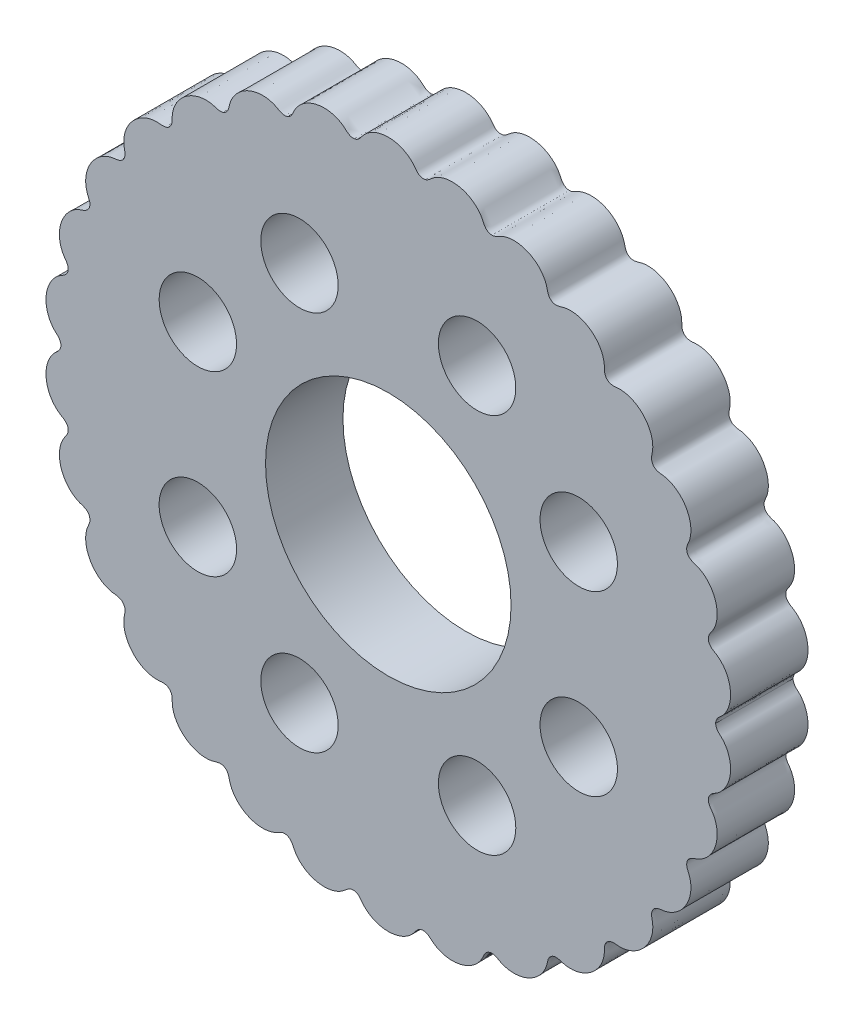
from build123d import *

# Parameters (mm, degrees)
BOSS_EXTRU_1_DEPTH      = 7
ESQUISSE2_R             = 3.5
ESQUISSE2_R_2           = 11.1
ENL_V_MAT_EXTRU_1_DEPTH = 45.429222529


with BuildPart() as part:
    # Esquisse1 → Boss.-Extru.1 (new body)
    with BuildSketch(Plane.XY):
        with BuildLine():
            add(Edge.make_bspline(
                [(29.6, 0), (29.6, -0.17346587), (29.759106864, -0.535683821), (30.110962154, -0.799020647), (30.373779595, -1.103467186), (30.671023666, -1.560938048), (30.906540811, -2.208142452), (30.979869374, -3.033375854), (30.845247931, -3.851352131), (30.565023341, -4.481835856), (30.246485608, -4.925727722), (29.960253365, -5.217593452), (29.640960083, -5.465239042), (29.250815494, -5.647425417), (28.885266009, -6.097323866), (28.977251739, -6.67834267), (29.271750181, -7.022312781), (29.468763653, -7.36916575), (29.619679918, -7.750390298), (29.740086607, -8.282593055), (29.751778171, -8.972575413), (29.555422294, -9.777910352), (29.16527121, -10.508677165), (28.695257551, -11.013160126), (28.244812231, -11.319043922), (27.880647842, -11.499834787), (27.471579825, -11.595893446), (27.006318633, -11.933415225), (26.943348567, -12.521679856), (27.160884744, -12.93167147), (27.28616792, -13.308128069), (27.382434324, -13.846858227), (27.347084399, -14.533511523), (27.091766805, -15.321922336), (26.647653324, -16.021873377), (26.143416519, -16.492765788), (25.676630094, -16.777708905), (25.300421903, -16.935538553), (24.906058058, -17.040890389), (24.494101091, -17.052935571), (23.964164193, -17.258068951), (23.748162441, -17.811308884), (23.871884113, -18.272098831), (23.921990477, -18.662658592), (23.912556095, -19.073830569), (23.816632957, -19.610230054), (23.55779036, -20.250114552), (23.0619827, -20.914113125), (22.524366522, -21.347803801), (22.039223061, -21.602326195), (21.65347199, -21.742191386), (21.253820824, -21.822573441), (20.844527947, -21.847377521), (20.445954866, -21.779629443), (19.887950327, -21.842445056), (19.533169106, -22.321486778), (19.54913905, -22.809933424), (19.52364967, -23.201313883), (19.402047704, -23.736377502), (19.102706862, -24.354093818), (18.559180614, -24.980010528), (17.876540404, -25.450186019), (17.228367831, -25.686652916), (16.687037507, -25.767074422), (16.279495117, -25.766957178), (15.872536835, -25.709400019), (15.499435367, -25.567806904), (14.951946533, -25.489634994), (14.482469666, -25.858978976), (14.381997189, -26.350233363), (14.28318815, -26.727726776), (14.113532411, -27.103499941), (13.817229931, -27.559932344), (13.328856115, -28.047927141), (12.612717453, -28.46490585), (11.815803643, -28.691258289), (11.125530625, -28.703647155), (10.592785504, -28.596321983), (10.204619525, -28.458251539), (9.869656438, -28.250580278), (9.36658074, -28.041508581), (8.815683348, -28.274758843), (8.597136023, -28.738509951), (8.428826025, -29.090348232), (8.107333171, -29.536038305), (7.592223672, -29.988306479), (6.846929131, -30.351760445), (6.034805208, -30.517180952), (5.345658074, -30.481539312), (4.815617997, -30.344351904), (4.439970071, -30.186483287), (4.086904742, -29.973347138), (3.798973513, -29.707611401), (3.371132482, -29.38740255), (2.777656314, -29.466938238), (2.447129594, -29.873895348), (2.215574619, -30.187513863), (1.912079782, -30.467158531), (1.462361721, -30.772632638), (0.822066691, -31.031016675), (2.605e-06, -31.134490934), (-0.822065298, -31.03101861), (-1.462347798, -30.772627846), (-1.912078643, -30.467167923), (-2.215568462, -30.18754546), (-2.446981162, -29.873962582), (-2.777700278, -29.466906136), (-3.371115881, -29.387410247), (-3.798972625, -29.707607875), (-4.086902915, -29.973347378), (-4.439969921, -30.186483038), (-4.815617939, -30.344351951), (-5.34565821, -30.481539306), (-6.034805188, -30.517180961), (-6.846929138, -30.351760446), (-7.592223668, -29.988306482), (-8.10733317, -29.536038305), (-8.428826025, -29.090348234), (-8.597136023, -28.738509951), (-8.815683348, -28.274758843), (-9.36658074, -28.041508581), (-9.869656438, -28.250580278), (-10.204619526, -28.458251539), (-10.592785504, -28.596321983), (-11.125530625, -28.703647155), (-11.815803643, -28.691258289), (-12.612717453, -28.46490585), (-13.328856115, -28.047927141), (-13.817229931, -27.559932344), (-14.113532411, -27.103499941), (-14.28318815, -26.727726776), (-14.381997189, -26.350233363), (-14.482469666, -25.858978976), (-14.951946533, -25.489634994), (-15.499435367, -25.567806904), (-15.872536835, -25.709400019), (-16.279495117, -25.766957178), (-16.687037507, -25.767074422), (-17.228367831, -25.686652916), (-17.876540404, -25.450186019), (-18.559180614, -24.980010528), (-19.102706862, -24.354093818), (-19.402047704, -23.736377502), (-19.52364967, -23.201313883), (-19.54913905, -22.809933424), (-19.533169106, -22.321486778), (-19.887950327, -21.842445056), (-20.445954866, -21.779629443), (-20.844527947, -21.847377521), (-21.253820824, -21.822573441), (-21.65347199, -21.742191386), (-22.039223061, -21.602326195), (-22.524366522, -21.347803801), (-23.0619827, -20.914113125), (-23.55779036, -20.250114552), (-23.816632957, -19.610230054), (-23.912556095, -19.073830569), (-23.921990477, -18.662658592), (-23.871884113, -18.272098831), (-23.748162441, -17.811308884), (-23.964164193, -17.258068951), (-24.494101091, -17.052935571), (-24.906058058, -17.040890389), (-25.300421903, -16.935538553), (-25.676630094, -16.777708905), (-26.143416519, -16.492765788), (-26.647653324, -16.021873377), (-27.091766805, -15.321922336), (-27.347084399, -14.533511523), (-27.382434324, -13.846858227), (-27.28616792, -13.308128069), (-27.160884744, -12.93167147), (-26.943348567, -12.521679856), (-27.006318633, -11.933415225), (-27.471579825, -11.595893446), (-27.880647842, -11.499834787), (-28.244812231, -11.319043922), (-28.695257551, -11.013160126), (-29.16527121, -10.508677165), (-29.555422294, -9.777910352), (-29.751778171, -8.972575413), (-29.740086607, -8.282593055), (-29.619679918, -7.750390298), (-29.468763653, -7.36916575), (-29.271750181, -7.022312781), (-28.977251739, -6.67834267), (-28.885266009, -6.097323865), (-29.250815494, -5.647425417), (-29.640960087, -5.465239037), (-29.960253369, -5.21759345), (-30.246485627, -4.925727692), (-30.565023311, -4.481835895), (-30.845247881, -3.851352289), (-30.979869416, -3.033375465), (-30.906540141, -2.208144398), (-30.671024291, -1.560932394), (-30.373775505, -1.103469197), (-30.110957739, -0.799017142), (-29.759108597, -0.535685391), (-29.6, -0.173466016), (-29.6, 0)],
                knots=[0.074015259, 0.074015259, 0.074015259, 0.074015259, 0.077343265, 0.080671271, 0.083999277, 0.087327283, 0.093983294, 0.100639306, 0.107295317, 0.113951329, 0.117279335, 0.12060734, 0.123935346, 0.127263352, 0.130591358, 0.133919364, 0.137247369, 0.140575375, 0.143903381, 0.147231387, 0.153887398, 0.16054341, 0.167199421, 0.173855433, 0.177183439, 0.180511445, 0.18383945, 0.187167456, 0.190495462, 0.193823468, 0.197151474, 0.200479479, 0.207135491, 0.213791502, 0.220447514, 0.227103526, 0.230431531, 0.233759537, 0.237087543, 0.240415549, 0.243743555, 0.24707156, 0.250399566, 0.253727572, 0.257055578, 0.260383583, 0.267039595, 0.273695607, 0.280351618, 0.283679624, 0.28700763, 0.290335636, 0.293663641, 0.296991647, 0.300319653, 0.303647659, 0.306975664, 0.31030367, 0.313631676, 0.320287688, 0.326943699, 0.333599711, 0.340255722, 0.343583728, 0.346911734, 0.35023974, 0.353567745, 0.356895751, 0.360223757, 0.363551763, 0.366879769, 0.370207774, 0.37353578, 0.380191792, 0.386847803, 0.393503815, 0.400159826, 0.403487832, 0.406815838, 0.410143844, 0.41347185, 0.416799855, 0.420127861, 0.423455867, 0.426783873, 0.433439884, 0.440095896, 0.446751907, 0.453407919, 0.456735925, 0.460063931, 0.463391936, 0.466719942, 0.470047948, 0.473375954, 0.47670396, 0.480031965, 0.483359971, 0.486687977, 0.493343988, 0.5, 0.506656012, 0.513312023, 0.516640029, 0.519968035, 0.52329604, 0.526624046, 0.529952052, 0.533280058, 0.536608064, 0.539936069, 0.543264075, 0.546592081, 0.553248093, 0.559904104, 0.566560116, 0.573216127, 0.576544133, 0.579872139, 0.583200145, 0.58652815, 0.589856156, 0.593184162, 0.596512168, 0.599840174, 0.606496185, 0.613152197, 0.619808208, 0.62646422, 0.629792226, 0.633120231, 0.636448237, 0.639776243, 0.643104249, 0.646432255, 0.64976026, 0.653088266, 0.656416272, 0.659744278, 0.666400289, 0.673056301, 0.679712312, 0.686368324, 0.68969633, 0.693024336, 0.696352341, 0.699680347, 0.703008353, 0.706336359, 0.709664364, 0.71299237, 0.716320376, 0.719648382, 0.726304393, 0.732960405, 0.739616417, 0.742944422, 0.746272428, 0.749600434, 0.75292844, 0.756256445, 0.759584451, 0.762912457, 0.766240463, 0.769568469, 0.772896474, 0.779552486, 0.786208498, 0.792864509, 0.799520521, 0.802848526, 0.806176532, 0.809504538, 0.812832544, 0.81616055, 0.819488555, 0.822816561, 0.826144567, 0.832800579, 0.83945659, 0.846112602, 0.852768613, 0.856096619, 0.859424625, 0.862752631, 0.866080636, 0.869408642, 0.872736648, 0.876064654, 0.87939266, 0.882720665, 0.886048671, 0.892704683, 0.899360694, 0.906016706, 0.912672717, 0.916000723, 0.919328729, 0.922656735, 0.925984741, 0.925984741, 0.925984741, 0.925984741], degree=3))
            add(Edge.make_bspline(
                [(-29.6, 0), (-29.6, 0.173466016), (-29.759108597, 0.535685391), (-30.110957739, 0.799017142), (-30.373775505, 1.103469197), (-30.671024291, 1.560932394), (-30.906540141, 2.208144398), (-30.979869416, 3.033375465), (-30.845247881, 3.851352289), (-30.565023311, 4.481835895), (-30.246485627, 4.925727692), (-29.960253369, 5.21759345), (-29.640960087, 5.465239037), (-29.250815494, 5.647425417), (-28.885266009, 6.097323865), (-28.977251739, 6.67834267), (-29.271750181, 7.022312781), (-29.468763653, 7.36916575), (-29.619679918, 7.750390298), (-29.740086607, 8.282593055), (-29.751778171, 8.972575413), (-29.555422294, 9.777910352), (-29.16527121, 10.508677165), (-28.695257551, 11.013160126), (-28.244812231, 11.319043922), (-27.880647842, 11.499834787), (-27.471579825, 11.595893446), (-27.006318633, 11.933415225), (-26.943348567, 12.521679856), (-27.160884744, 12.93167147), (-27.28616792, 13.308128069), (-27.382434324, 13.846858227), (-27.347084399, 14.533511523), (-27.091766805, 15.321922336), (-26.647653324, 16.021873377), (-26.143416519, 16.492765788), (-25.676630094, 16.777708905), (-25.300421903, 16.935538553), (-24.906058058, 17.040890389), (-24.494101091, 17.052935571), (-23.964164193, 17.258068951), (-23.748162441, 17.811308884), (-23.871884113, 18.272098831), (-23.921990477, 18.662658592), (-23.912556095, 19.073830569), (-23.816632957, 19.610230054), (-23.55779036, 20.250114552), (-23.0619827, 20.914113125), (-22.524366522, 21.347803801), (-22.039223061, 21.602326195), (-21.65347199, 21.742191386), (-21.253820824, 21.822573441), (-20.844527947, 21.847377521), (-20.445954866, 21.779629443), (-19.887950327, 21.842445056), (-19.533169106, 22.321486778), (-19.54913905, 22.809933424), (-19.52364967, 23.201313883), (-19.402047704, 23.736377502), (-19.102706862, 24.354093818), (-18.559180614, 24.980010528), (-17.876540404, 25.450186019), (-17.228367831, 25.686652916), (-16.687037507, 25.767074422), (-16.279495117, 25.766957178), (-15.872536835, 25.709400019), (-15.499435367, 25.567806904), (-14.951946533, 25.489634994), (-14.482469666, 25.858978976), (-14.381997189, 26.350233363), (-14.28318815, 26.727726776), (-14.113532411, 27.103499941), (-13.817229931, 27.559932344), (-13.328856115, 28.047927141), (-12.612717453, 28.46490585), (-11.815803643, 28.691258289), (-11.125530625, 28.703647155), (-10.592785504, 28.596321983), (-10.204619526, 28.458251539), (-9.869656438, 28.250580278), (-9.36658074, 28.041508581), (-8.815683348, 28.274758843), (-8.597136023, 28.738509951), (-8.428826025, 29.090348234), (-8.10733317, 29.536038305), (-7.592223668, 29.988306482), (-6.846929138, 30.351760446), (-6.034805188, 30.517180961), (-5.34565821, 30.481539306), (-4.815617939, 30.344351951), (-4.439969921, 30.186483038), (-4.086902915, 29.973347378), (-3.798972625, 29.707607875), (-3.371115881, 29.387410247), (-2.777700278, 29.466906136), (-2.446981162, 29.873962582), (-2.215568462, 30.18754546), (-1.912078643, 30.467167923), (-1.462347798, 30.772627846), (-0.822065298, 31.03101861), (2.605e-06, 31.134490934), (0.822066691, 31.031016675), (1.462361721, 30.772632638), (1.912079782, 30.467158531), (2.215574619, 30.187513863), (2.447129594, 29.873895348), (2.777656314, 29.466938238), (3.371132482, 29.38740255), (3.798973513, 29.707611401), (4.086904742, 29.973347138), (4.439970071, 30.186483287), (4.815617997, 30.344351904), (5.345658074, 30.481539312), (6.034805208, 30.517180952), (6.846929131, 30.351760445), (7.592223672, 29.988306479), (8.107333171, 29.536038305), (8.428826025, 29.090348232), (8.597136023, 28.738509951), (8.815683348, 28.274758843), (9.36658074, 28.041508581), (9.869656438, 28.250580278), (10.204619526, 28.458251539), (10.592785504, 28.596321983), (11.125530625, 28.703647155), (11.815803643, 28.691258289), (12.612717453, 28.46490585), (13.328856115, 28.047927141), (13.817229931, 27.559932344), (14.113532411, 27.103499941), (14.28318815, 26.727726776), (14.381997189, 26.350233363), (14.482469666, 25.858978976), (14.951946533, 25.489634994), (15.499435367, 25.567806904), (15.872536835, 25.709400019), (16.279495117, 25.766957178), (16.687037507, 25.767074422), (17.228367831, 25.686652916), (17.876540404, 25.450186019), (18.559180614, 24.980010528), (19.102706862, 24.354093818), (19.402047704, 23.736377502), (19.52364967, 23.201313883), (19.54913905, 22.809933424), (19.533169106, 22.321486778), (19.887950327, 21.842445056), (20.445954866, 21.779629443), (20.844527947, 21.847377521), (21.253820824, 21.822573441), (21.65347199, 21.742191386), (22.039223061, 21.602326195), (22.524366522, 21.347803801), (23.0619827, 20.914113125), (23.55779036, 20.250114552), (23.816632957, 19.610230054), (23.912556095, 19.073830569), (23.921990477, 18.662658592), (23.871884113, 18.272098831), (23.748162441, 17.811308884), (23.964164193, 17.258068951), (24.494101091, 17.052935571), (24.906058058, 17.040890389), (25.300421903, 16.935538553), (25.676630094, 16.777708905), (26.143416519, 16.492765788), (26.647653324, 16.021873377), (27.091766805, 15.321922336), (27.347084399, 14.533511523), (27.382434324, 13.846858227), (27.28616792, 13.308128069), (27.160884744, 12.93167147), (26.943348567, 12.521679856), (27.006318633, 11.933415225), (27.471579825, 11.595893446), (27.880647842, 11.499834787), (28.244812231, 11.319043922), (28.695257551, 11.013160126), (29.16527121, 10.508677165), (29.555422294, 9.777910352), (29.751778171, 8.972575413), (29.740086607, 8.282593055), (29.619679918, 7.750390298), (29.468763653, 7.36916575), (29.271750181, 7.022312781), (28.977251739, 6.67834267), (28.885266009, 6.097323866), (29.250815494, 5.647425417), (29.640960083, 5.465239042), (29.960253365, 5.217593452), (30.246485608, 4.925727722), (30.565023341, 4.481835856), (30.845247931, 3.851352131), (30.979869374, 3.033375854), (30.906540811, 2.208142452), (30.671023666, 1.560938048), (30.373779595, 1.103467186), (30.110962154, 0.799020647), (29.759106864, 0.535683821), (29.6, 0.17346587), (29.6, 0)],
                knots=[0.074015259, 0.074015259, 0.074015259, 0.074015259, 0.077343265, 0.080671271, 0.083999277, 0.087327283, 0.093983294, 0.100639306, 0.107295317, 0.113951329, 0.117279335, 0.12060734, 0.123935346, 0.127263352, 0.130591358, 0.133919364, 0.137247369, 0.140575375, 0.143903381, 0.147231387, 0.153887398, 0.16054341, 0.167199421, 0.173855433, 0.177183439, 0.180511445, 0.18383945, 0.187167456, 0.190495462, 0.193823468, 0.197151474, 0.200479479, 0.207135491, 0.213791502, 0.220447514, 0.227103526, 0.230431531, 0.233759537, 0.237087543, 0.240415549, 0.243743555, 0.24707156, 0.250399566, 0.253727572, 0.257055578, 0.260383583, 0.267039595, 0.273695607, 0.280351618, 0.283679624, 0.28700763, 0.290335636, 0.293663641, 0.296991647, 0.300319653, 0.303647659, 0.306975664, 0.31030367, 0.313631676, 0.320287688, 0.326943699, 0.333599711, 0.340255722, 0.343583728, 0.346911734, 0.35023974, 0.353567745, 0.356895751, 0.360223757, 0.363551763, 0.366879769, 0.370207774, 0.37353578, 0.380191792, 0.386847803, 0.393503815, 0.400159826, 0.403487832, 0.406815838, 0.410143844, 0.41347185, 0.416799855, 0.420127861, 0.423455867, 0.426783873, 0.433439884, 0.440095896, 0.446751907, 0.453407919, 0.456735925, 0.460063931, 0.463391936, 0.466719942, 0.470047948, 0.473375954, 0.47670396, 0.480031965, 0.483359971, 0.486687977, 0.493343988, 0.5, 0.506656012, 0.513312023, 0.516640029, 0.519968035, 0.52329604, 0.526624046, 0.529952052, 0.533280058, 0.536608064, 0.539936069, 0.543264075, 0.546592081, 0.553248093, 0.559904104, 0.566560116, 0.573216127, 0.576544133, 0.579872139, 0.583200145, 0.58652815, 0.589856156, 0.593184162, 0.596512168, 0.599840174, 0.606496185, 0.613152197, 0.619808208, 0.62646422, 0.629792226, 0.633120231, 0.636448237, 0.639776243, 0.643104249, 0.646432255, 0.64976026, 0.653088266, 0.656416272, 0.659744278, 0.666400289, 0.673056301, 0.679712312, 0.686368324, 0.68969633, 0.693024336, 0.696352341, 0.699680347, 0.703008353, 0.706336359, 0.709664364, 0.71299237, 0.716320376, 0.719648382, 0.726304393, 0.732960405, 0.739616417, 0.742944422, 0.746272428, 0.749600434, 0.75292844, 0.756256445, 0.759584451, 0.762912457, 0.766240463, 0.769568469, 0.772896474, 0.779552486, 0.786208498, 0.792864509, 0.799520521, 0.802848526, 0.806176532, 0.809504538, 0.812832544, 0.81616055, 0.819488555, 0.822816561, 0.826144567, 0.832800579, 0.83945659, 0.846112602, 0.852768613, 0.856096619, 0.859424625, 0.862752631, 0.866080636, 0.869408642, 0.872736648, 0.876064654, 0.87939266, 0.882720665, 0.886048671, 0.892704683, 0.899360694, 0.906016706, 0.912672717, 0.916000723, 0.919328729, 0.922656735, 0.925984741, 0.925984741, 0.925984741, 0.925984741], degree=3))
        make_face()
    extrude(amount=BOSS_EXTRU_1_DEPTH)

    # Esquisse2 → Enlèv. mat.-Extru.1 (cut, through all)
    with BuildSketch(Plane.XY.offset(7)):
        with Locations((-8.029746973, 17.219847954)):
            Circle(ESQUISSE2_R)
        with Locations(Location((8.029746973, 17.219847954, 0), (0, 0, 180))):
            Circle(ESQUISSE2_R)
        with Locations((17.219847954, 8.029746973)):
            Circle(ESQUISSE2_R)
        with Locations(Location((17.219847954, -8.029746973, 0), (0, 0, 180))):
            Circle(ESQUISSE2_R)
        with Locations((8.029746973, -17.219847954)):
            Circle(ESQUISSE2_R)
        with Locations(Location((-8.029746973, -17.219847954, 0), (0, 0, 180))):
            Circle(ESQUISSE2_R)
        with Locations((-17.219847954, -8.029746973)):
            Circle(ESQUISSE2_R)
        with Locations(Location((-17.219847954, 8.029746973, 0), (0, 0, 180))):
            Circle(ESQUISSE2_R)
        Circle(ESQUISSE2_R_2)
    extrude(amount=-ENL_V_MAT_EXTRU_1_DEPTH, mode=Mode.SUBTRACT)


solid = part.part
